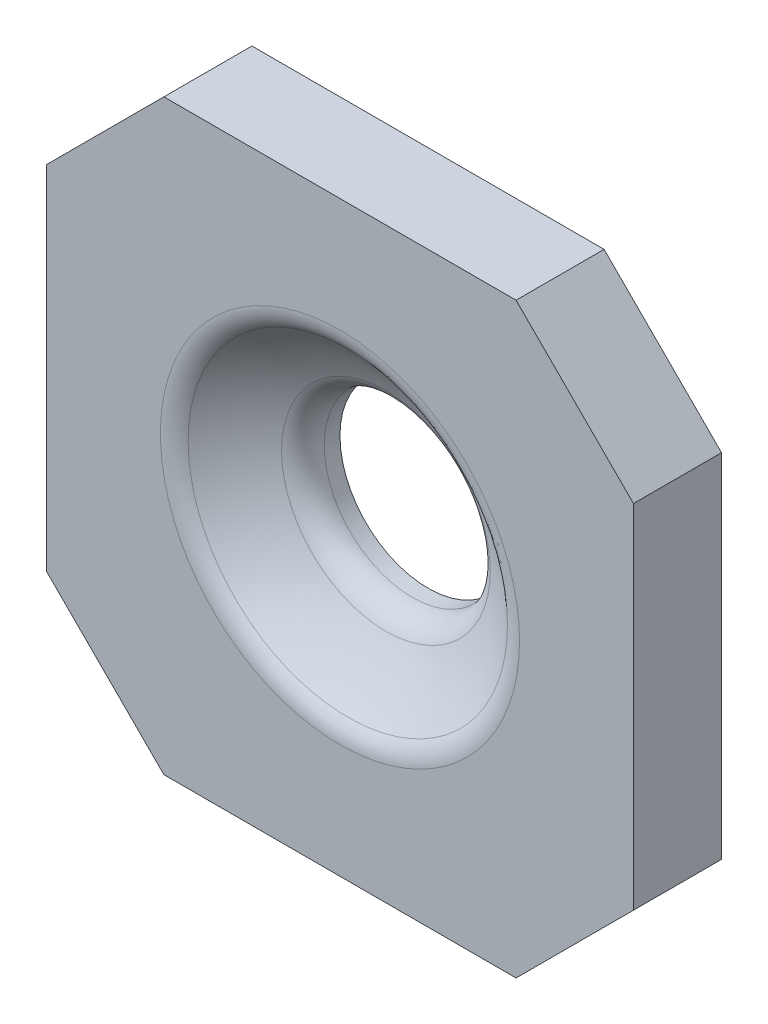
from build123d import *

# Parameters (mm, degrees)
SKETCH_2_W         = 100
SKETCH_2_H         = 100
EXTRUDE_1_DEPTH    = 15
SKETCH3_R          = 15
CUT_EXTRUDE1_DEPTH = 73.284161474
CHAMFER_1_SIZE     = 20
FILLET1_R          = 5
FILLET_1_R         = 5


with BuildPart() as part:
    # ｽｹｯﾁ2 → ﾎﾞｽ - 押し出し1 (new body)
    with BuildSketch(Plane.XY):
        Rectangle(SKETCH_2_W, SKETCH_2_H)
    extrude(amount=EXTRUDE_1_DEPTH)

    # ｽｹｯﾁ3 → ｶｯﾄ - 回転1 (revolve, cut)
    with BuildSketch(Plane(origin=(0, 0, 0), x_dir=(1, 0, 0), z_dir=(0, 1, 0))):
        with BuildLine():
            Line((0, -83), (0, -3))
            ThreePointArc((0, -3), (40, -43), (0, -83))
        make_face()
    revolve(axis=Axis((0, 0, 83), (0, 0, -1)), mode=Mode.SUBTRACT)

    # Sketch3 → Cut-Extrude1 (cut, through all)
    with BuildSketch(Plane(origin=(0, 0, 0), x_dir=(-1, 0, 0), z_dir=(0, 0, -1))):
        Circle(SKETCH3_R)
    extrude(amount=-CUT_EXTRUDE1_DEPTH, mode=Mode.SUBTRACT)

    # 面取り1
    chamfer_1_edges = [part.edges().sort_by_distance(p)[0] for p in [
        (50, -50, 7.5),
        (-50, -50, 7.5),
        (-50, 50, 7.5),
        (50, 50, 7.5),
    ]]
    chamfer(chamfer_1_edges, length=CHAMFER_1_SIZE)

    # Fillet1
    fillet1_edges = [part.edges().sort_by_distance(p)[0] for p in [
        (0, -15, 5.919007565),
    ]]
    fillet(fillet1_edges, radius=FILLET1_R)

    # ﾌｨﾚｯﾄ1
    fillet_1_edges = [part.edges().sort_by_distance(p)[0] for p in [
        (-28.565713714, 0, 15),
    ]]
    fillet(fillet_1_edges, radius=FILLET_1_R)


solid = part.part
